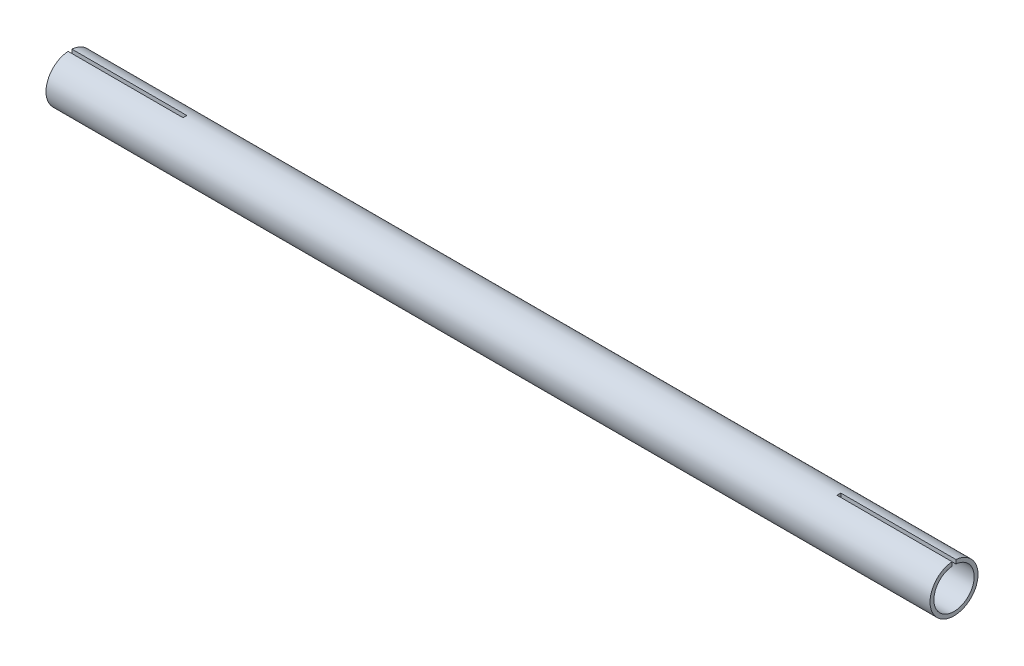
from build123d import *

# Parameters (mm, degrees)
ESBO_O2_R                = 12.5
ESBO_O2_R_2              = 10.5
RESSALTO_EXTRUS_O1_DEPTH = 230.5
ESBO_O3_W                = 2
ESBO_O3_H                = 5
CORTE_EXTRUS_O1_DEPTH    = 60


with BuildPart() as part:
    # Esboço2 → Ressalto-extrusão1 (new, symmetric)
    with BuildSketch(Plane(origin=(0, 0, 0), x_dir=(0, 0, -1), z_dir=(1, 0, 0))):
        Circle(ESBO_O2_R)
        Circle(ESBO_O2_R_2, mode=Mode.SUBTRACT)
    extrude(amount=RESSALTO_EXTRUS_O1_DEPTH, both=True)

    # Esboço3 → Corte-extrusão1 (cut)
    with BuildSketch(Plane(origin=(230.5, 0, 0), x_dir=(0, 0, -1), z_dir=(1, 0, 0))):
        with Locations((0, 12.5)):
            Rectangle(ESBO_O3_W, ESBO_O3_H)
    corte_extrus_o1 = extrude(amount=-CORTE_EXTRUS_O1_DEPTH, mode=Mode.SUBTRACT)

    # Espelhar1: Corte-extrusão1 across plane
    add(corte_extrus_o1.mirror(Plane(origin=(0, 0, 0), x_dir=(0, 0, 1), z_dir=(1, 0, 0))), mode=Mode.SUBTRACT)


solid = part.part
